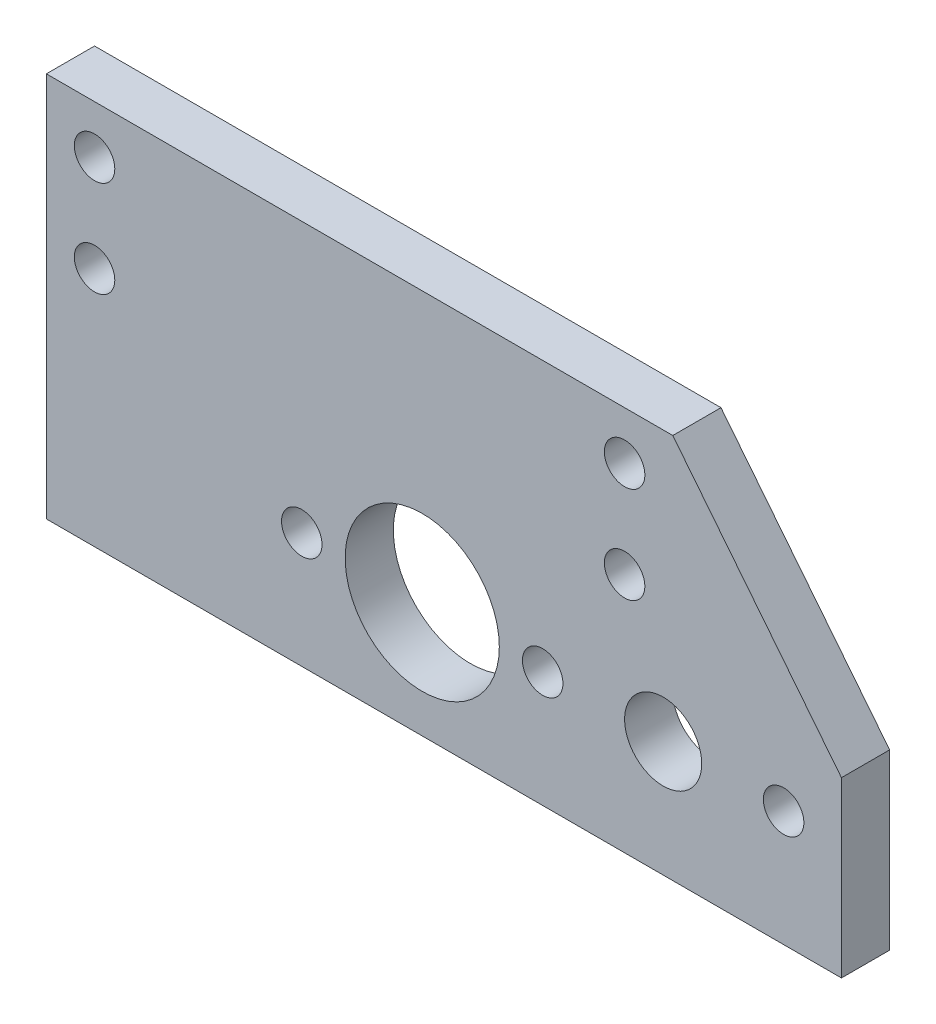
from build123d import *

# Parameters (mm, degrees)
SKETCH1_R           = 2.1
SKETCH1_R_2         = 4
SKETCH1_R_3         = 8
BOSS_EXTRUDE1_DEPTH = 5


with BuildPart() as part:
    # Sketch1 → Boss-Extrude1 (new body)
    with BuildSketch(Plane.XY):
        Polygon((116.611470678, 15.338509317), (51.611470678, 15.338509317), (51.611470678, -6.661490683), (51.611470678, -24.661490683), (116.611470678, -24.661490683), (134.111470678, -24.661490683), (134.111470678, -6.661490683), align=None)
        with Locations((56.611470678, 10.338509317)):
            Circle(SKETCH1_R, mode=Mode.SUBTRACT)
        with Locations((111.611470678, 10.338509317)):
            Circle(SKETCH1_R, mode=Mode.SUBTRACT)
        with Locations((56.611470678, 0.338509317)):
            Circle(SKETCH1_R, mode=Mode.SUBTRACT)
        with Locations((111.611470678, 0.338509317)):
            Circle(SKETCH1_R, mode=Mode.SUBTRACT)
        with Locations((115.611470678, -12.661490683)):
            Circle(SKETCH1_R_2, mode=Mode.SUBTRACT)
        with Locations((90.611470678, -12.661490683)):
            Circle(SKETCH1_R_3, mode=Mode.SUBTRACT)
        with Locations((78.111470678, -12.661490683)):
            Circle(SKETCH1_R, mode=Mode.SUBTRACT)
        with Locations((103.111470678, -12.661490683)):
            Circle(SKETCH1_R, mode=Mode.SUBTRACT)
        with Locations((128.111470678, -12.661490683)):
            Circle(SKETCH1_R, mode=Mode.SUBTRACT)
    extrude(amount=BOSS_EXTRUDE1_DEPTH)


solid = part.part
